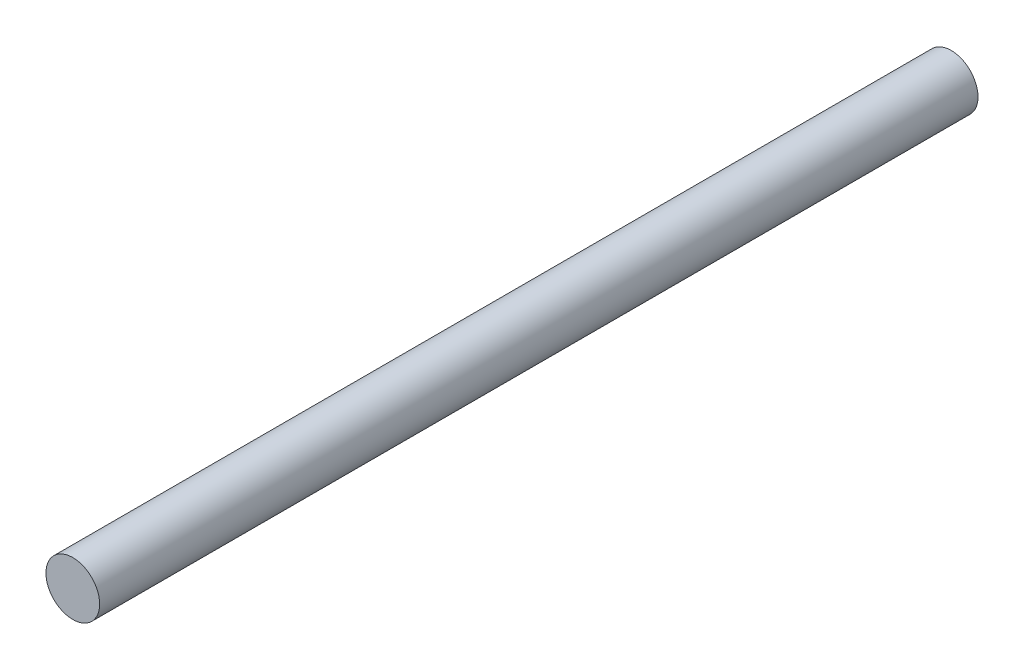
from build123d import *

# Parameters (mm, degrees)
SKETCH2_R           = 3.175
BOSS_EXTRUDE1_DEPTH = 103.886


with BuildPart() as part:
    # Sketch2 → Boss-Extrude1 (new body)
    with BuildSketch(Plane.XY):
        Circle(SKETCH2_R)
    extrude(amount=BOSS_EXTRUDE1_DEPTH)


solid = part.part
